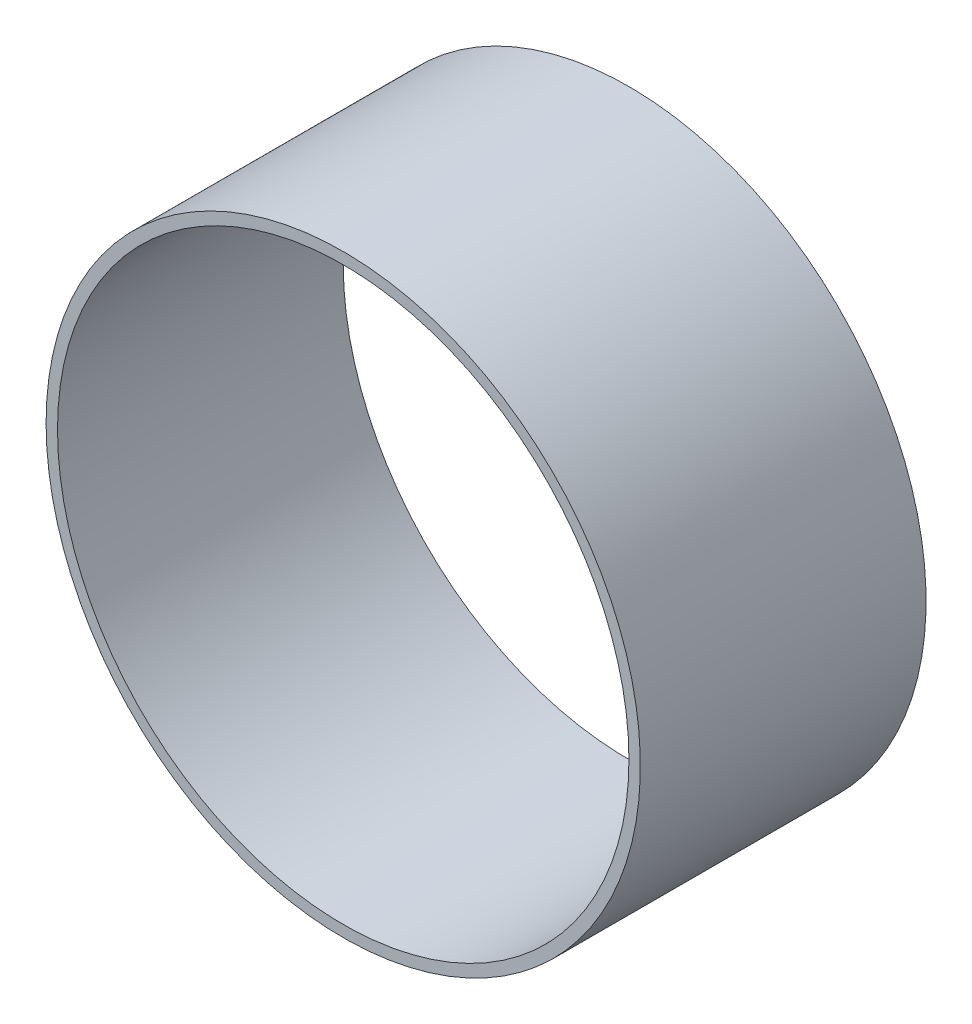
from build123d import *

# Parameters (mm, degrees)
SKETCH1_R           = 39.624
SKETCH1_R_2         = 38.1
BOSS_EXTRUDE1_DEPTH = 38.1


with BuildPart() as part:
    # Sketch1 → Boss-Extrude1 (new body)
    with BuildSketch(Plane.XY):
        with Locations(Location((0, 0, 0), (0, 0, 180))):
            Circle(SKETCH1_R)
        with Locations(Location((0, 0, 0), (0, 0, 180))):
            Circle(SKETCH1_R_2, mode=Mode.SUBTRACT)
    extrude(amount=BOSS_EXTRUDE1_DEPTH)


solid = part.part
